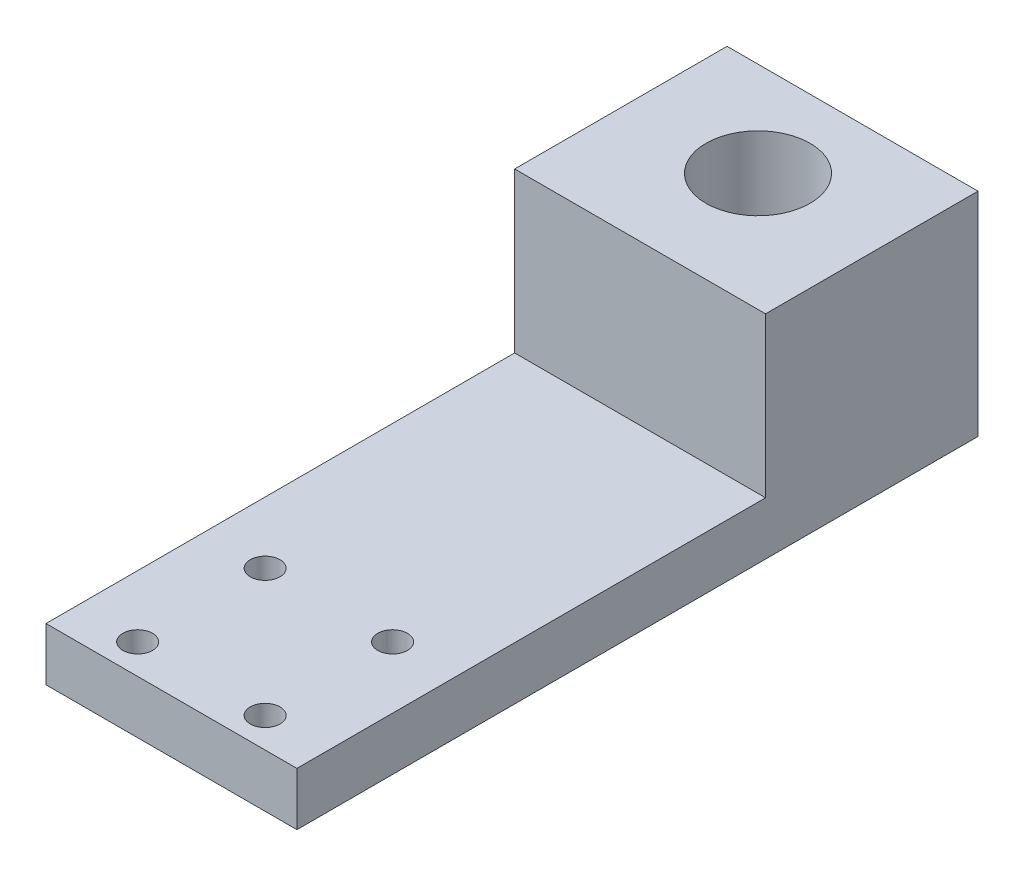
from build123d import *

# Parameters (mm, degrees)
SKETCH1_W           = 15
SKETCH1_H           = 28.0162
SKETCH1_R           = 0.889
BOSS_EXTRUDE1_DEPTH = 3.175
SKETCH1_3_W         = 15
SKETCH1_3_H         = 12.7
SKETCH1_3_R         = 3.1115
BOSS_EXTRUDE2_DEPTH = 12.7


with BuildPart() as part:
    # Sketch1 → Boss-Extrude1 (new body)
    with BuildSketch(Plane(origin=(0, 0, 0), x_dir=(1, 0, 0), z_dir=(0, 1, 0))):
        with Locations((7.5, -26.7081)):
            Rectangle(SKETCH1_W, SKETCH1_H)
        with Locations((3.69, -38.9262)):
            Circle(SKETCH1_R, mode=Mode.SUBTRACT)
        with Locations((3.69, -31.3062)):
            Circle(SKETCH1_R, mode=Mode.SUBTRACT)
        with Locations((11.31, -38.9262)):
            Circle(SKETCH1_R, mode=Mode.SUBTRACT)
        with Locations((11.31, -31.3062)):
            Circle(SKETCH1_R, mode=Mode.SUBTRACT)
    extrude(amount=BOSS_EXTRUDE1_DEPTH)

    # Sketch1<3> → Boss-Extrude2 (add)
    with BuildSketch(Plane(origin=(0, 0, 0), x_dir=(1, 0, 0), z_dir=(0, 1, 0))):
        with Locations((7.5, -6.35)):
            Rectangle(SKETCH1_3_W, SKETCH1_3_H)
        with Locations((7.5, -5.6515)):
            Circle(SKETCH1_3_R, mode=Mode.SUBTRACT)
    extrude(amount=BOSS_EXTRUDE2_DEPTH)


solid = part.part
